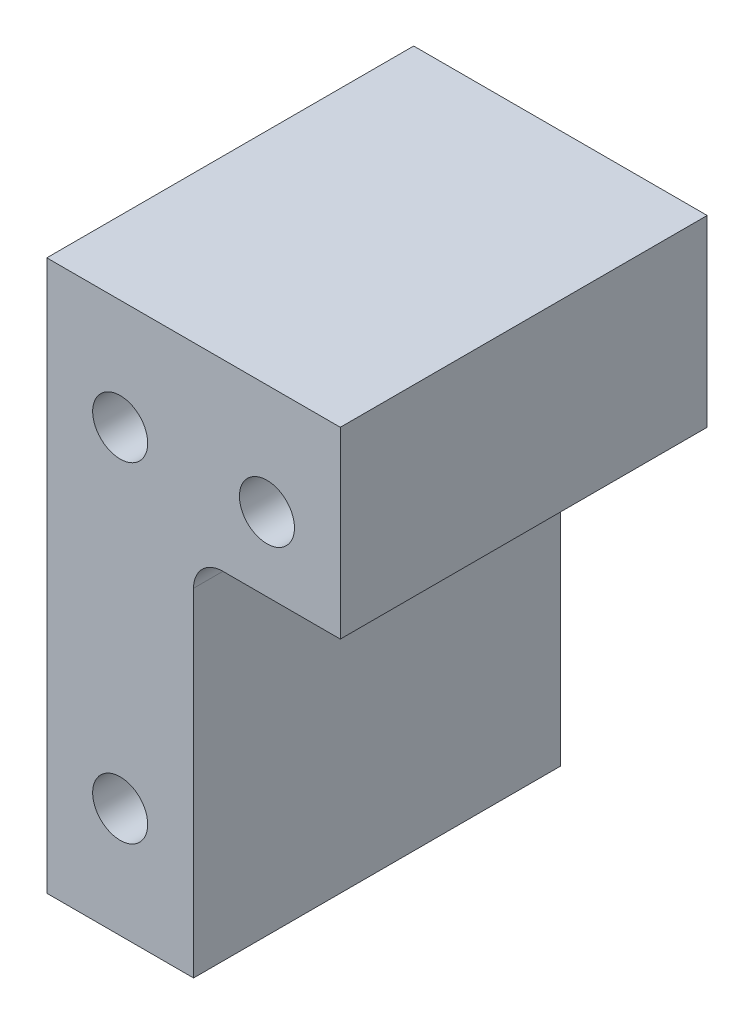
from build123d import *

# Parameters (mm, degrees)
SKETCH1_R           = 1.905
BOSS_EXTRUDE1_DEPTH = 25.4


with BuildPart() as part:
    # Sketch1 → Boss-Extrude1 (new body)
    with BuildSketch(Plane.XY):
        with BuildLine():
            Line((0, 0), (0, 38.1))
            Line((0, 38.1), (20.32, 38.1))
            Line((20.32, 38.1), (20.32, 25.4))
            Line((20.32, 25.4), (12.192, 25.4))
            ThreePointArc((12.192, 25.4), (10.755159021, 24.804840979), (10.16, 23.368))
            Line((10.16, 23.368), (10.16, 0))
            Line((10.16, 0), (0, 0))
        make_face()
        with Locations((5.08, 30.48)):
            Circle(SKETCH1_R, mode=Mode.SUBTRACT)
        with Locations((5.08, 7.62)):
            Circle(SKETCH1_R, mode=Mode.SUBTRACT)
        with Locations((15.24, 30.48)):
            Circle(SKETCH1_R, mode=Mode.SUBTRACT)
    extrude(amount=BOSS_EXTRUDE1_DEPTH)


solid = part.part
